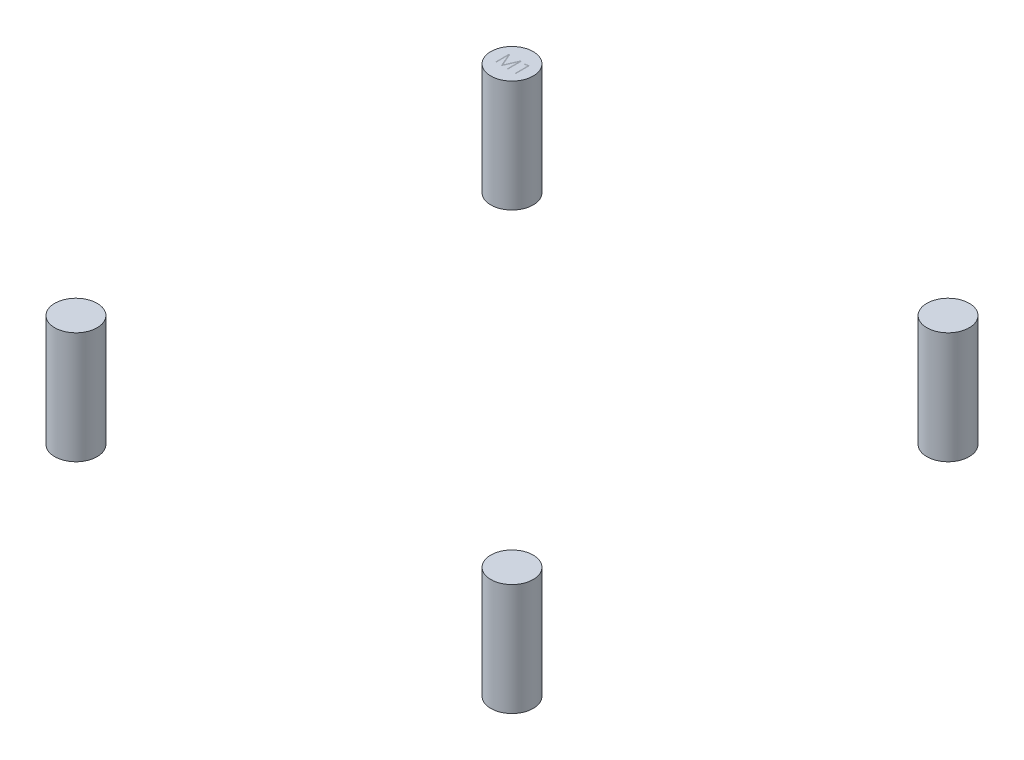
from build123d import *

# Parameters (mm, degrees)
SKETCH1_R             = 2.96
BOSS_EXTRUDE1_DEPTH   = 15.6
BOSS_EXTRUDE1_2_DEPTH = 15.6
BOSS_EXTRUDE1_3_DEPTH = 15.6
BOSS_EXTRUDE1_4_DEPTH = 15.6


with BuildPart() as part:
    # Sketch1 → Boss-Extrude1 (new body)
    with BuildSketch(Plane(origin=(0, 0, 0), x_dir=(1, 0, 0), z_dir=(0, 1, 0))):
        with Locations(Location((-30.445, 30.445, 0), (0, 0, 270))):
            Circle(SKETCH1_R)
    extrude(amount=BOSS_EXTRUDE1_DEPTH)


with BuildPart() as body_2:
    # Sketch1 → Boss-Extrude1 2 (new body)
    with BuildSketch(Plane(origin=(0, 0, 0), x_dir=(1, 0, 0), z_dir=(0, 1, 0))):
        with Locations(Location((30.445, 30.445, 0), (0, 0, 270))):
            Circle(SKETCH1_R)
    extrude(amount=BOSS_EXTRUDE1_2_DEPTH)


with BuildPart() as body_3:
    # Sketch1 → Boss-Extrude1 3 (new body)
    with BuildSketch(Plane(origin=(0, 0, 0), x_dir=(1, 0, 0), z_dir=(0, 1, 0))):
        with Locations(Location((30.445, -30.445, 0), (0, 0, 270))):
            Circle(SKETCH1_R)
    extrude(amount=BOSS_EXTRUDE1_3_DEPTH)


with BuildPart() as body_4:
    # Sketch1 → Boss-Extrude1 4 (new body)
    with BuildSketch(Plane(origin=(0, 0, 0), x_dir=(1, 0, 0), z_dir=(0, 1, 0))):
        with Locations(Location((-30.445, -30.445, 0), (0, 0, 270))):
            Circle(SKETCH1_R)
    extrude(amount=BOSS_EXTRUDE1_4_DEPTH)


solid = Compound([part.part, body_2.part, body_3.part, body_4.part])
